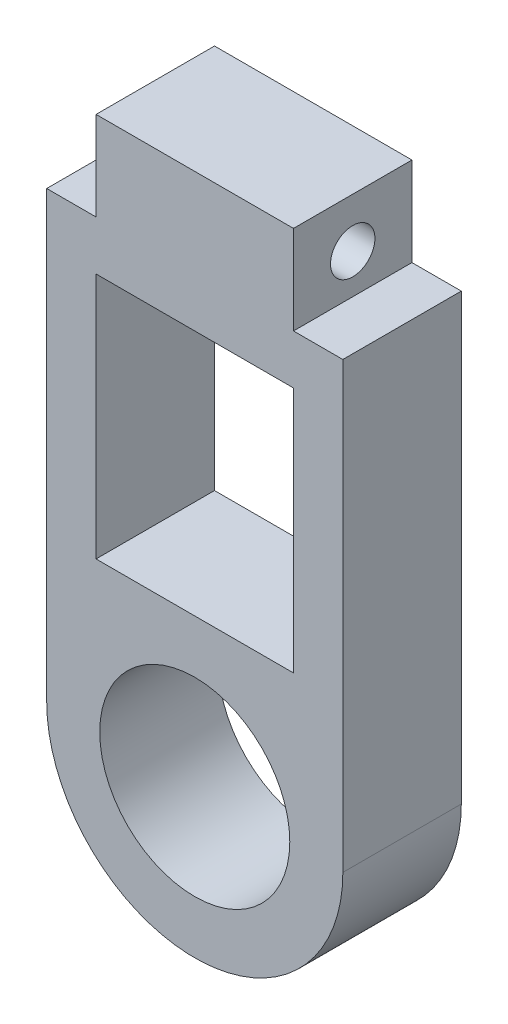
from build123d import *

# Parameters (mm, degrees)
SKETCH1_R           = 9.625
SKETCH1_W           = 20
SKETCH1_H           = 25
BOSS_EXTRUDE1_DEPTH = 12
SKETCH2_R           = 2.25
CUT_EXTRUDE1_DEPTH  = 69.381198132


with BuildPart() as part:
    # Sketch1 → Boss-Extrude1 (new body)
    with BuildSketch(Plane.XY):
        with BuildLine():
            Line((-10, -2.505905785), (-10, 6.494094215))
            Line((-10, 6.494094215), (10, 6.494094215))
            Line((10, 6.494094215), (10, -2.505905785))
            Line((10, -2.505905785), (15, -2.505905785))
            Line((15, -2.505905785), (15, -47.505905785))
            ThreePointArc((15, -47.505905785), (0, -62.505905785), (-15, -47.505905785))
            Line((-15, -47.505905785), (-15, -2.505905785))
            Line((-15, -2.505905785), (-10, -2.505905785))
        make_face()
        with Locations((0, -47.505905785)):
            Circle(SKETCH1_R, mode=Mode.SUBTRACT)
        with Locations((0, -20.005905785)):
            Rectangle(SKETCH1_W, SKETCH1_H, mode=Mode.SUBTRACT)
    extrude(amount=BOSS_EXTRUDE1_DEPTH)

    # Sketch2 → Cut-Extrude1 (cut, through all)
    with BuildSketch(Plane(origin=(10, 0, 0), x_dir=(0, 0, -1), z_dir=(1, 0, 0))):
        with Locations(Location((-6, 1.494094215, 0), (0, 0, 90))):
            Circle(SKETCH2_R)
    extrude(amount=-CUT_EXTRUDE1_DEPTH, mode=Mode.SUBTRACT)


solid = part.part
